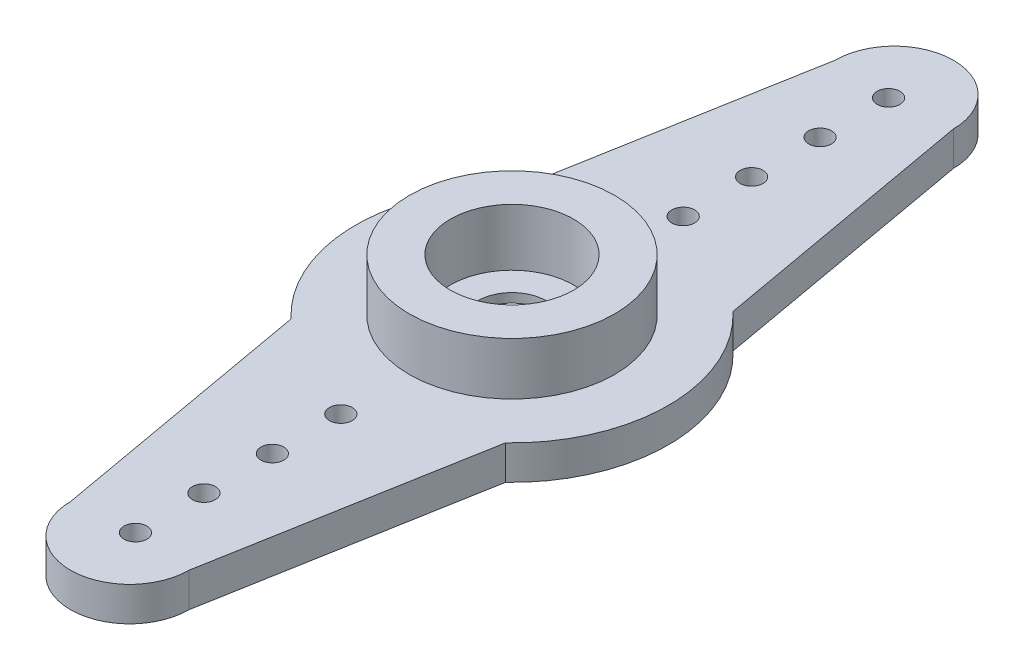
from build123d import *

# Parameters (mm, degrees)
CROQUIS2_R              = 0.5
SALIENTE_EXTRUIR1_DEPTH = 1.5
CROQUIS3_R              = 4.5
SALIENTE_EXTRUIR2_DEPTH = 2.3
CROQUIS4_R              = 3
CORTAR_EXTRUIR1_DEPTH   = 0.9
CROQUIS5_R              = 1.5
CORTAR_EXTRUIR2_DEPTH   = 21.730533037
CROQUIS6_R              = 2.7
CORTAR_EXTRUIR3_DEPTH   = 2.5


with BuildPart() as part:
    # Croquis2 → Saliente-Extruir1 (new body)
    with BuildSketch(Plane(origin=(0, 0, 0), x_dir=(1, 0, 0), z_dir=(0, 1, 0))):
        with BuildLine():
            Line((2.6, 16.75), (4.7, 4.983221849))
            ThreePointArc((4.7, 4.983221849), (6.85, 0), (4.7, -4.983221849))
            Line((4.7, -4.983221849), (2.6, -16.75))
            ThreePointArc((2.6, -16.75), (0, -19.35), (-2.6, -16.75))
            Line((-2.6, -16.75), (-4.7, -4.983221849))
            ThreePointArc((-4.7, -4.983221849), (-6.85, 0), (-4.7, 4.983221849))
            Line((-4.7, 4.983221849), (-2.6, 16.75))
            ThreePointArc((-2.6, 16.75), (0, 19.35), (2.6, 16.75))
        make_face()
        with Locations(Location((0, -16.5, 0), (0, 0, 90))):
            Circle(CROQUIS2_R, mode=Mode.SUBTRACT)
        with Locations(Location((0, -13.5, 0), (0, 0, 90))):
            Circle(CROQUIS2_R, mode=Mode.SUBTRACT)
        with Locations(Location((0, -10.5, 0), (0, 0, 90))):
            Circle(CROQUIS2_R, mode=Mode.SUBTRACT)
        with Locations(Location((0, -7.5, 0), (0, 0, 90))):
            Circle(CROQUIS2_R, mode=Mode.SUBTRACT)
        with Locations(Location((0, 7.5, 0), (0, 0, 270))):
            Circle(CROQUIS2_R, mode=Mode.SUBTRACT)
        with Locations(Location((0, 10.5, 0), (0, 0, 270))):
            Circle(CROQUIS2_R, mode=Mode.SUBTRACT)
        with Locations(Location((0, 13.5, 0), (0, 0, 270))):
            Circle(CROQUIS2_R, mode=Mode.SUBTRACT)
        with Locations(Location((0, 16.5, 0), (0, 0, 270))):
            Circle(CROQUIS2_R, mode=Mode.SUBTRACT)
    extrude(amount=SALIENTE_EXTRUIR1_DEPTH)

    # Croquis3 → Saliente-Extruir2 (add)
    with BuildSketch(Plane(origin=(0, 1.5, 0), x_dir=(1, 0, 0), z_dir=(0, 1, 0))):
        with Locations(Location((0, 0, 0), (0, 0, 270))):
            Circle(CROQUIS3_R)
    extrude(amount=SALIENTE_EXTRUIR2_DEPTH)

    # Croquis4 → Cortar-Extruir1 (cut)
    with BuildSketch(Plane.XZ):
        with Locations(Location((0, 0, 0), (0, 0, 270))):
            Circle(CROQUIS4_R)
    extrude(amount=-CORTAR_EXTRUIR1_DEPTH, mode=Mode.SUBTRACT)

    # Croquis5 → Cortar-Extruir2 (cut, through all)
    with BuildSketch(Plane.XZ.offset(-0.9)):
        with Locations(Location((0, 0, 0), (0, 0, 270))):
            Circle(CROQUIS5_R)
    extrude(amount=-CORTAR_EXTRUIR2_DEPTH, mode=Mode.SUBTRACT)

    # Croquis6 → Cortar-Extruir3 (cut)
    with BuildSketch(Plane(origin=(0, 3.8, 0), x_dir=(1, 0, 0), z_dir=(0, 1, 0))):
        with Locations(Location((0, 0, 0), (0, 0, 270))):
            Circle(CROQUIS6_R)
    extrude(amount=-CORTAR_EXTRUIR3_DEPTH, mode=Mode.SUBTRACT)


solid = part.part
